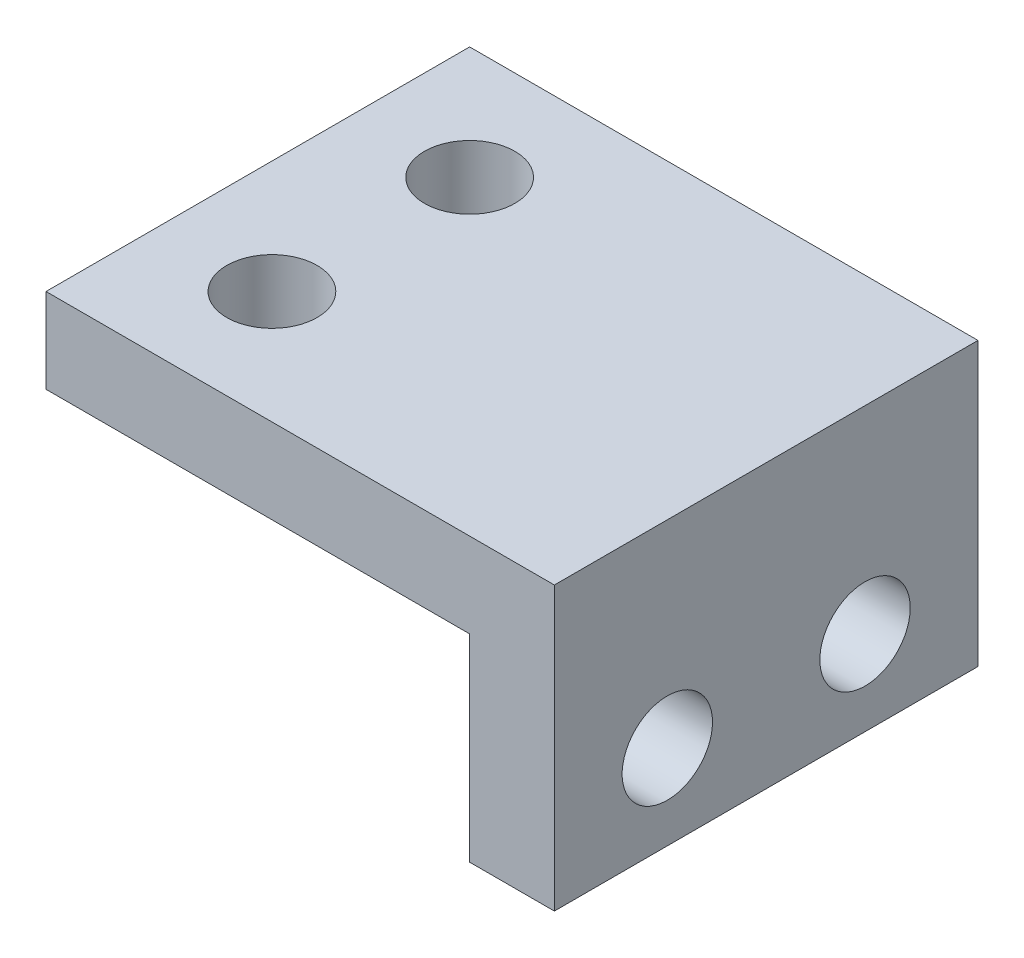
from build123d import *

# Parameters (mm, degrees)
BOSS_EXTRUDE1_DEPTH = 7.5
SKETCH2_R           = 1.6
CUT_EXTRUDE1_DEPTH  = 15
SKETCH3_R           = 1.6
CUT_EXTRUDE2_DEPTH  = 15


with BuildPart() as part:
    # Sketch1 → Boss-Extrude1 (new, symmetric)
    with BuildSketch(Plane.XY):
        Polygon((0, 0), (-15, 0), (-15, 3), (3, 3), (3, -7), (0, -7), align=None)
    extrude(amount=BOSS_EXTRUDE1_DEPTH, both=True)

    # Sketch2 → Cut-Extrude1 (cut)
    with BuildSketch(Plane(origin=(0, 3, 0), x_dir=(1, 0, 0), z_dir=(0, 1, 0))):
        with Locations(Location((-11, 3.5, 0), (0, 0, 180))):
            Circle(SKETCH2_R)
        with Locations(Location((-11, -3.5, 0), (0, 0, 180))):
            Circle(SKETCH2_R)
    extrude(amount=-CUT_EXTRUDE1_DEPTH, mode=Mode.SUBTRACT)

    # Sketch3 → Cut-Extrude2 (cut)
    with BuildSketch(Plane(origin=(3, 0, 0), x_dir=(0, 0, -1), z_dir=(1, 0, 0))):
        with Locations((-3.5, -4)):
            Circle(SKETCH3_R)
        with Locations((3.5, -4)):
            Circle(SKETCH3_R)
    extrude(amount=-CUT_EXTRUDE2_DEPTH, mode=Mode.SUBTRACT)


solid = part.part
